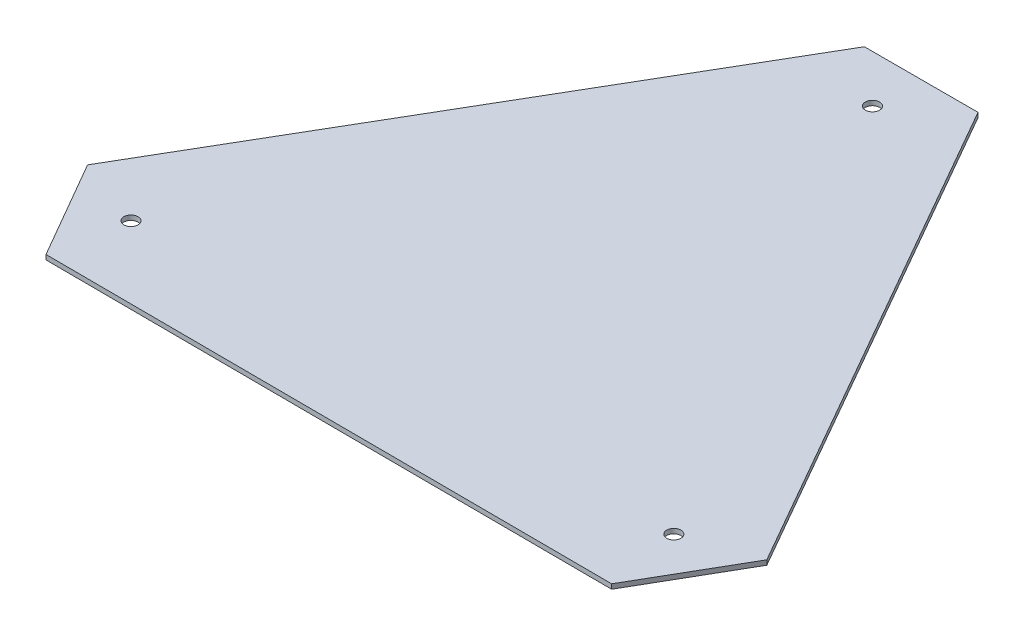
from build123d import *

# Parameters (mm, degrees)
CROQUIS1_R              = 1.5
SALIENTE_EXTRUIR1_DEPTH = 1


with BuildPart() as part:
    # Croquis1 → Saliente-Extruir1 (new body)
    with BuildSketch(Plane(origin=(0, 0, 0), x_dir=(1, 0, 0), z_dir=(0, 1, 0))):
        Polygon((-11.705527007, 76.209609723), (12.294472993, 76.209609723), (71.852221536, -27.967521109), (59.852221536, -48.7521308), (-60.146694529, -48.242088614), (-72.146694529, -27.457478924), align=None)
        with Locations(Location((0, 66.209609723, 0), (0, 0, 270))):
            Circle(CROQUIS1_R, mode=Mode.SUBTRACT)
        with Locations(Location((57.339203995, -33.104804862, 0), (0, 0, 270))):
            Circle(CROQUIS1_R, mode=Mode.SUBTRACT)
        with Locations(Location((-57.339203995, -33.104804862, 0), (0, 0, 270))):
            Circle(CROQUIS1_R, mode=Mode.SUBTRACT)
    extrude(amount=SALIENTE_EXTRUIR1_DEPTH)


solid = part.part
